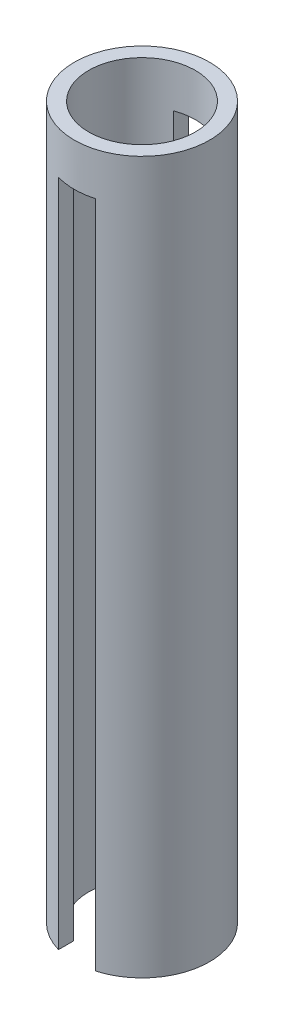
from build123d import *

# Parameters (mm, degrees)
SKETCH1_R           = 9.5
SKETCH1_R_2         = 7.5
BOSS_EXTRUDE1_DEPTH = 100
SKETCH2_W           = 5.2
SKETCH2_H           = 94
CUT_EXTRUDE1_DEPTH  = 100


with BuildPart() as part:
    # Sketch1 → Boss-Extrude1 (new body)
    with BuildSketch(Plane(origin=(0, 0, 0), x_dir=(1, 0, 0), z_dir=(0, 1, 0))):
        with Locations(Location((0, 0, 0), (0, 0, 270))):
            Circle(SKETCH1_R)
        with Locations(Location((0, 0, 0), (0, 0, 270))):
            Circle(SKETCH1_R_2, mode=Mode.SUBTRACT)
    extrude(amount=BOSS_EXTRUDE1_DEPTH)

    # Sketch2 → Cut-Extrude1 (cut)
    with BuildSketch(Plane.XY.offset(20)):
        with Locations((0, 47)):
            Rectangle(SKETCH2_W, SKETCH2_H)
    extrude(amount=-CUT_EXTRUDE1_DEPTH, mode=Mode.SUBTRACT)


solid = part.part
